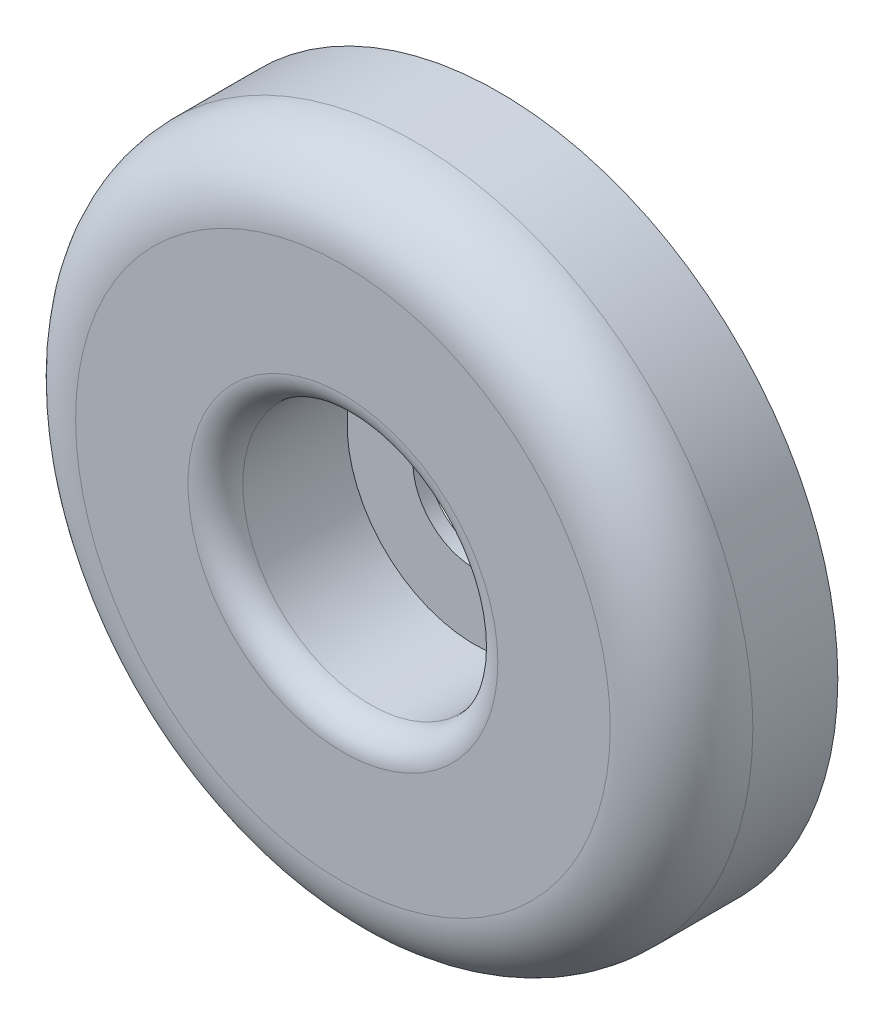
from build123d import *


with BuildPart() as part:
    # Esquisse1 → Révolution1 (revolve)
    with BuildSketch(Plane(origin=(0, 0, 0), x_dir=(0, 0, -1), z_dir=(1, 0, 0)), mode=Mode.PRIVATE) as r_volution1_sk:
        with BuildLine():
            Line((0, 2.25), (0.5, 2.25))
            Line((0.5, 2.25), (0.5, 4.65))
            Line((0.5, 4.65), (0.9, 4.65))
            Line((0.9, 4.65), (0.9, 12.35))
            Line((0.9, 12.35), (-2.1, 12.35))
            Line((-2.1, 12.35), (-2.2, 12.35))
            ThreePointArc((-2.2, 12.35), (-4.038477631, 11.588477631), (-4.8, 9.75))
            Line((-4.8, 9.75), (-4.8, 5.65))
            ThreePointArc((-4.8, 5.65), (-4.507106781, 4.942893219), (-3.8, 4.65))
            Line((-3.8, 4.65), (0, 4.65))
            Line((0, 4.65), (0, 2.25))
        make_face()
    revolve(r_volution1_sk.sketch.rotate(Axis((0, 0, 13.052048193), (0, 0, -1)), 90), axis=Axis((0, 0, 13.052048193), (0, 0, -1)))


solid = part.part
